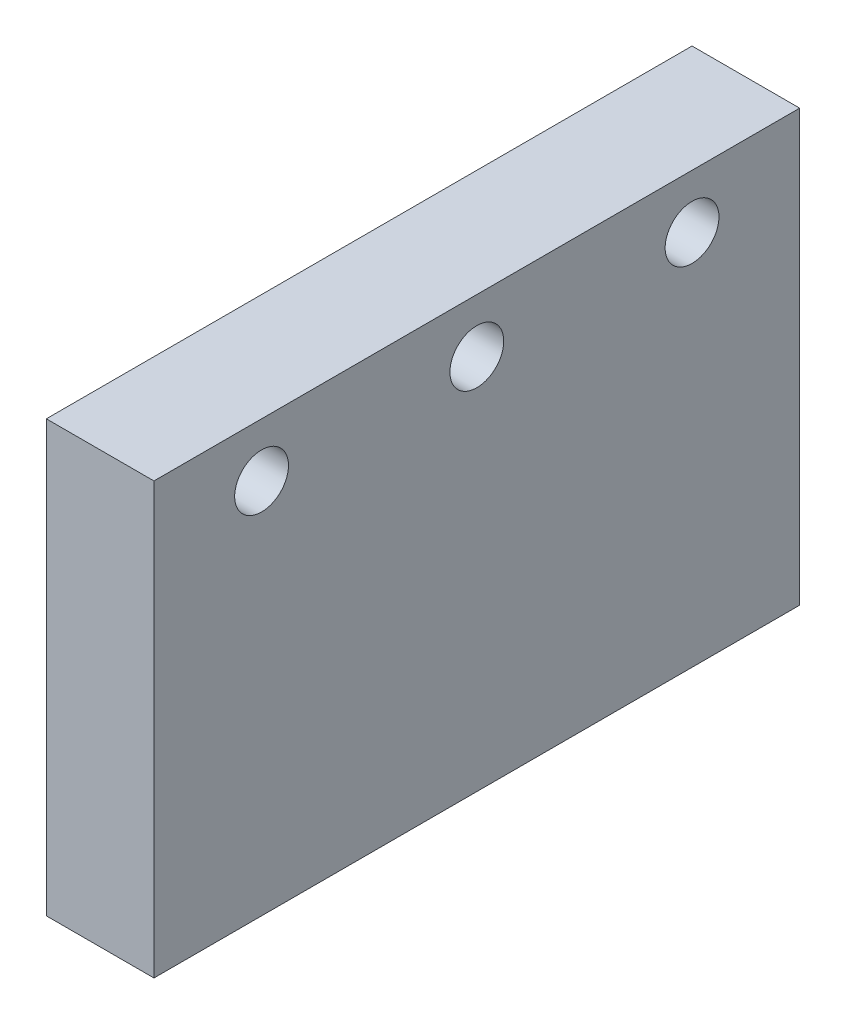
from build123d import *

# Parameters (mm, degrees)
BOSS_EXTRUDE1_DEPTH      = 38.1
F_1_4_20_THREADED_HOLE_D = 6.35


with BuildPart() as part:
    # Sketch2 → Boss-Extrude1 (new, symmetric)
    with BuildSketch(Plane.XY):
        Polygon((-6.35, 25.4), (6.35, 25.4), (6.35, -12.7), (6.35, -25.4), (-6.35, -25.4), (-6.35, 12.7), align=None)
    extrude(amount=BOSS_EXTRUDE1_DEPTH, both=True)

    # 1/4"-20 threaded hole (through all)
    with Locations(Plane(origin=(6.35, 0, 0), x_dir=(0, 0, -1), z_dir=(1, 0, 0))):
        with Locations((-25.4, 19.05), (0, 19.05), (25.4, 19.05)):
            Hole(F_1_4_20_THREADED_HOLE_D / 2)


solid = part.part
